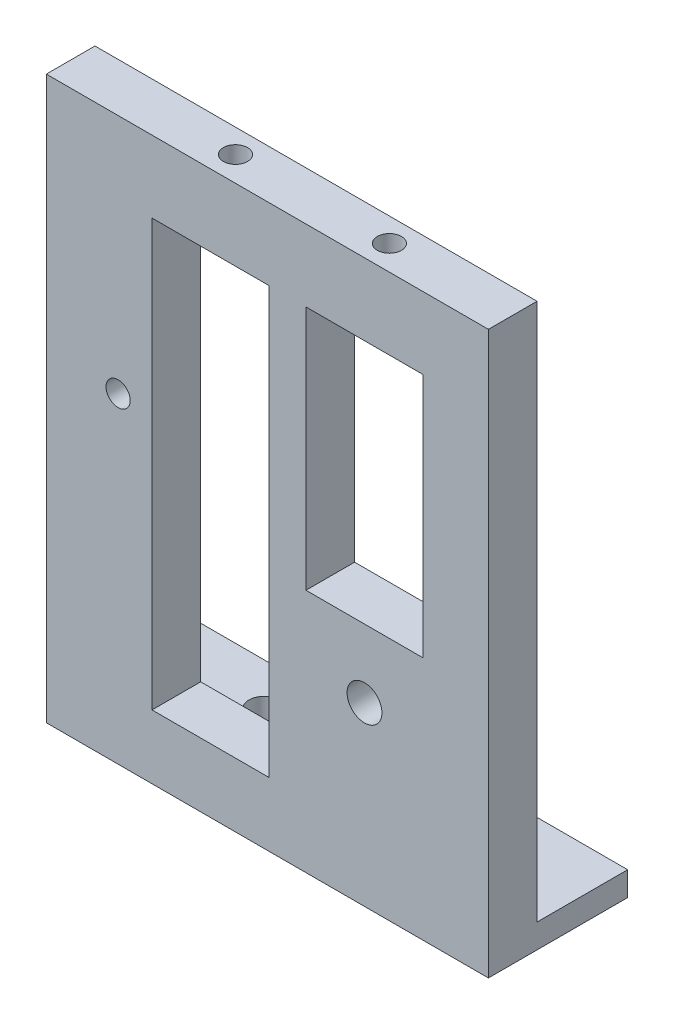
from build123d import *

# Parameters (mm, degrees)
SKETCH_1_W                      = 365.93
SKETCH_1_H                      = 455
SKETCH_1_R                      = 10
SKETCH_1_R_2                    = 14.438127561
SKETCH_1_W_2                    = 96.91
SKETCH_1_H_2                    = 352.59
SKETCH_1_H_3                    = 203.096012828
EXTRUDE_1_DEPTH                 = 40.26
CUT_EXTRUDE_1_REACH             = 1042.764
SKETCH_2_R                      = 10
CUT_EXTRUDE_1_DIRECTION_2_DEPTH = 1041.76399807
SKETCH_3_W                      = 365.93
SKETCH_3_H                      = 20
EXTRUDE_2_DEPTH                 = 80
CUT_EXTRUDE_2_REACH             = 1086.862
SKETCH_6_R                      = 12.5
CUT_EXTRUDE_4_DEPTH             = 1571.967331718
CUT_EXTRUDE_4_DEPTH_BACK        = 1571.967331718
SKETCH_9_W                      = 5
SKETCH_9_H                      = 20
CUT_EXTRUDE_5_DEPTH             = 1569.627549285
CUT_EXTRUDE_5_DEPTH_BACK        = 1569.627549285
SKETCH_10_W                     = 75
SKETCH_10_H                     = 10
SKETCH_11_W                     = 365.93
SKETCH_11_H                     = 115.26
SKETCH_11_R                     = 12.5
EXTRUDE_4_DEPTH                 = 10


with BuildPart() as part:
    # 草图1 → 凸台-拉伸1 (new body)
    with BuildSketch(Plane.XY.offset(-616.836895005)):
        with Locations((-483.659609698, 1110.678523142)):
            Rectangle(SKETCH_1_W, SKETCH_1_H)
        with Locations((-607.210787573, 1138.804962693)):
            Circle(SKETCH_1_R, mode=Mode.SUBTRACT)
        with Locations((-403.264609698, 1019.178523142)):
            Circle(SKETCH_1_R_2, mode=Mode.SUBTRACT)
        with Locations((-530.676153664, 1102.421638316)):
            Rectangle(SKETCH_1_W_2, SKETCH_1_H_2, mode=Mode.SUBTRACT)
        with Locations((-403.264609698, 1177.168631902)):
            Rectangle(SKETCH_1_W_2, SKETCH_1_H_3, mode=Mode.SUBTRACT)
    extrude(amount=-EXTRUDE_1_DEPTH)

    # 草图2 → 切除-拉伸1 (cut, up to next)
    with BuildSketch(Plane(origin=(0, 1338.178523142, 0), x_dir=(1, 0, 0), z_dir=(0, 1, 0)), mode=Mode.PRIVATE) as cut_extrude_1_sk1:
        with Locations(Location((-530.676153664, 637.446895005, 0), (0, 0, 90))):
            Circle(SKETCH_2_R)
    cut_extrude_1_tool1 = extrude(cut_extrude_1_sk1.sketch, amount=-CUT_EXTRUDE_1_REACH, mode=Mode.PRIVATE) & part.part
    # 草图2 → 切除-拉伸1 (cut, up to next)
    with BuildSketch(Plane(origin=(0, 1338.178523142, 0), x_dir=(1, 0, 0), z_dir=(0, 1, 0)), mode=Mode.PRIVATE) as cut_extrude_1_sk2:
        with Locations(Location((-403.264609698, 637.446895005, 0), (0, 0, 90))):
            Circle(SKETCH_2_R)
    cut_extrude_1_tool2 = extrude(cut_extrude_1_sk2.sketch, amount=-CUT_EXTRUDE_1_REACH, mode=Mode.PRIVATE) & part.part
    add(cut_extrude_1_tool1.solids().sort_by_distance((-530.676154, 1338.178523, -637.446895))[0], mode=Mode.SUBTRACT)
    add(cut_extrude_1_tool2.solids().sort_by_distance((-403.26461, 1338.178523, -637.446895))[0], mode=Mode.SUBTRACT)

    # 草图2 → 切除-拉伸1 direction 2 (cut)
    with BuildSketch(Plane(origin=(0, 1338.178523142, 0), x_dir=(1, 0, 0), z_dir=(0, 1, 0))):
        with Locations(Location((-530.676153664, 637.446895005, 0), (0, 0, 90))):
            Circle(SKETCH_2_R)
        with Locations(Location((-403.264609698, 637.446895005, 0), (0, 0, 90))):
            Circle(SKETCH_2_R)
    extrude(amount=CUT_EXTRUDE_1_DIRECTION_2_DEPTH, mode=Mode.SUBTRACT)

    # 草图3 → 凸台-拉伸2 (add)
    with BuildSketch(Plane(origin=(0, 0, -657.096895005), x_dir=(-1, 0, 0), z_dir=(0, 0, -1))):
        with Locations((483.659609698, 893.178523142)):
            Rectangle(SKETCH_3_W, SKETCH_3_H)
    extrude(amount=EXTRUDE_2_DEPTH)

    # 草图6 → 切除-拉伸2 (cut, up to next)
    with BuildSketch(Plane(origin=(0, 903.178523142, 0), x_dir=(1, 0, 0), z_dir=(0, 1, 0)), mode=Mode.PRIVATE) as cut_extrude_2_sk1:
        with Locations(Location((-566.624609698, 697.096895005, 0), (0, 0, 270))):
            Circle(SKETCH_6_R)
    cut_extrude_2_tool1 = extrude(cut_extrude_2_sk1.sketch, amount=-CUT_EXTRUDE_2_REACH, mode=Mode.PRIVATE) & part.part
    # 草图6 → 切除-拉伸2 (cut, up to next)
    with BuildSketch(Plane(origin=(0, 903.178523142, 0), x_dir=(1, 0, 0), z_dir=(0, 1, 0)), mode=Mode.PRIVATE) as cut_extrude_2_sk2:
        with Locations(Location((-400.694609698, 697.096895005, 0), (0, 0, 270))):
            Circle(SKETCH_6_R)
    cut_extrude_2_tool2 = extrude(cut_extrude_2_sk2.sketch, amount=-CUT_EXTRUDE_2_REACH, mode=Mode.PRIVATE) & part.part
    add(cut_extrude_2_tool1.solids().sort_by_distance((-566.62461, 903.178523, -697.096895))[0], mode=Mode.SUBTRACT)
    add(cut_extrude_2_tool2.solids().sort_by_distance((-400.69461, 903.178523, -697.096895))[0], mode=Mode.SUBTRACT)

    # 草图9 → 切除-拉伸4 (cut, two sides: drawn at the far end of the back side and taken through both)
    with BuildSketch(Plane(origin=(-300.694609698, 0, 0), x_dir=(0, 0, -1), z_dir=(1, 0, 0)).offset(-CUT_EXTRUDE_4_DEPTH_BACK)):
        with Locations((734.596895005, 893.178523142)):
            Rectangle(SKETCH_9_W, SKETCH_9_H)
    extrude(amount=CUT_EXTRUDE_4_DEPTH + CUT_EXTRUDE_4_DEPTH_BACK, mode=Mode.SUBTRACT)

    # 草图10 → 切除-拉伸5 (cut, two sides: drawn at the far end of the back side and taken through both)
    with BuildSketch(Plane(origin=(-300.694609698, 0, 0), x_dir=(0, 0, -1), z_dir=(1, 0, 0)).offset(-CUT_EXTRUDE_5_DEPTH_BACK)):
        with Locations((694.596895005, 898.178523142)):
            Rectangle(SKETCH_10_W, SKETCH_10_H)
    extrude(amount=CUT_EXTRUDE_5_DEPTH + CUT_EXTRUDE_5_DEPTH_BACK, mode=Mode.SUBTRACT)

    # 草图11 → 凸台-拉伸4 (add)
    with BuildSketch(Plane.XZ.offset(-883.178523142)):
        with Locations((-483.659609698, -674.466895005)):
            Rectangle(SKETCH_11_W, SKETCH_11_H)
        with Locations(Location((-400.694609698, -697.096895005, 0), (0, 0, 90))):
            Circle(SKETCH_11_R, mode=Mode.SUBTRACT)
        with Locations(Location((-566.624609698, -697.096895005, 0), (0, 0, 90))):
            Circle(SKETCH_11_R, mode=Mode.SUBTRACT)
    extrude(amount=EXTRUDE_4_DEPTH)


solid = part.part
